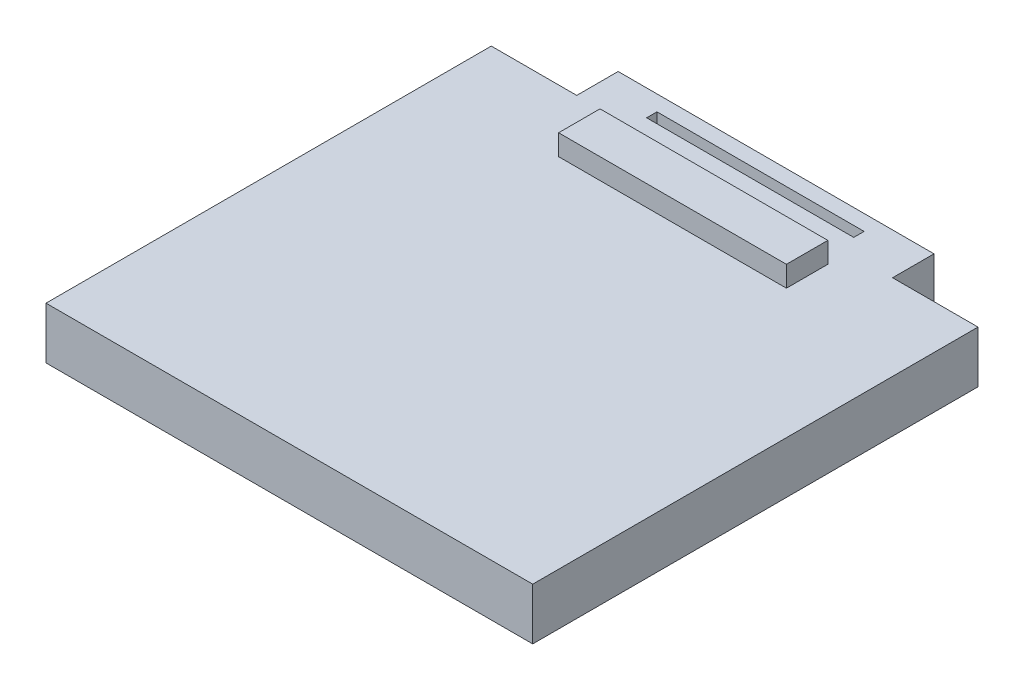
from build123d import *

# Parameters (mm, degrees)
CROQUIS1_W              = 23.5
CROQUIS1_H              = 21.5
SALIENTE_EXTRUIR1_DEPTH = 2.5
CROQUIS2_W              = 15.25
CROQUIS2_H              = 2.5
SALIENTE_EXTRUIR2_DEPTH = 2
CROQUIS4_W              = 11
CROQUIS4_H              = 2
SALIENTE_EXTRUIR4_DEPTH = 1
CROQUIS5_W              = 10
CROQUIS5_H              = 0.5
CORTAR_EXTRUIR1_DEPTH   = 0.75


with BuildPart() as part:
    # Croquis1 → Saliente-Extruir1 (new body)
    with BuildSketch(Plane(origin=(0, 0, 0), x_dir=(1, 0, 0), z_dir=(0, 1, 0))):
        Rectangle(CROQUIS1_W, CROQUIS1_H)
    extrude(amount=SALIENTE_EXTRUIR1_DEPTH)

    # Croquis2 → Saliente-Extruir2 (add)
    with BuildSketch(Plane(origin=(0, 0, -10.75), x_dir=(-1, 0, 0), z_dir=(0, 0, -1))):
        with Locations((0, 1.25)):
            Rectangle(CROQUIS2_W, CROQUIS2_H)
    extrude(amount=SALIENTE_EXTRUIR2_DEPTH)

    # Croquis4 → Saliente-Extruir4 (add)
    with BuildSketch(Plane(origin=(0, 2.5, 0), x_dir=(1, 0, 0), z_dir=(0, 1, 0))):
        with Locations((0, 8.75)):
            Rectangle(CROQUIS4_W, CROQUIS4_H)
    extrude(amount=SALIENTE_EXTRUIR4_DEPTH)

    # Croquis5 → Cortar-Extruir1 (cut)
    with BuildSketch(Plane(origin=(0, 2.5, 0), x_dir=(1, 0, 0), z_dir=(0, 1, 0))):
        with Locations((0, 11.75)):
            Rectangle(CROQUIS5_W, CROQUIS5_H)
    extrude(amount=-CORTAR_EXTRUIR1_DEPTH, mode=Mode.SUBTRACT)


solid = part.part
